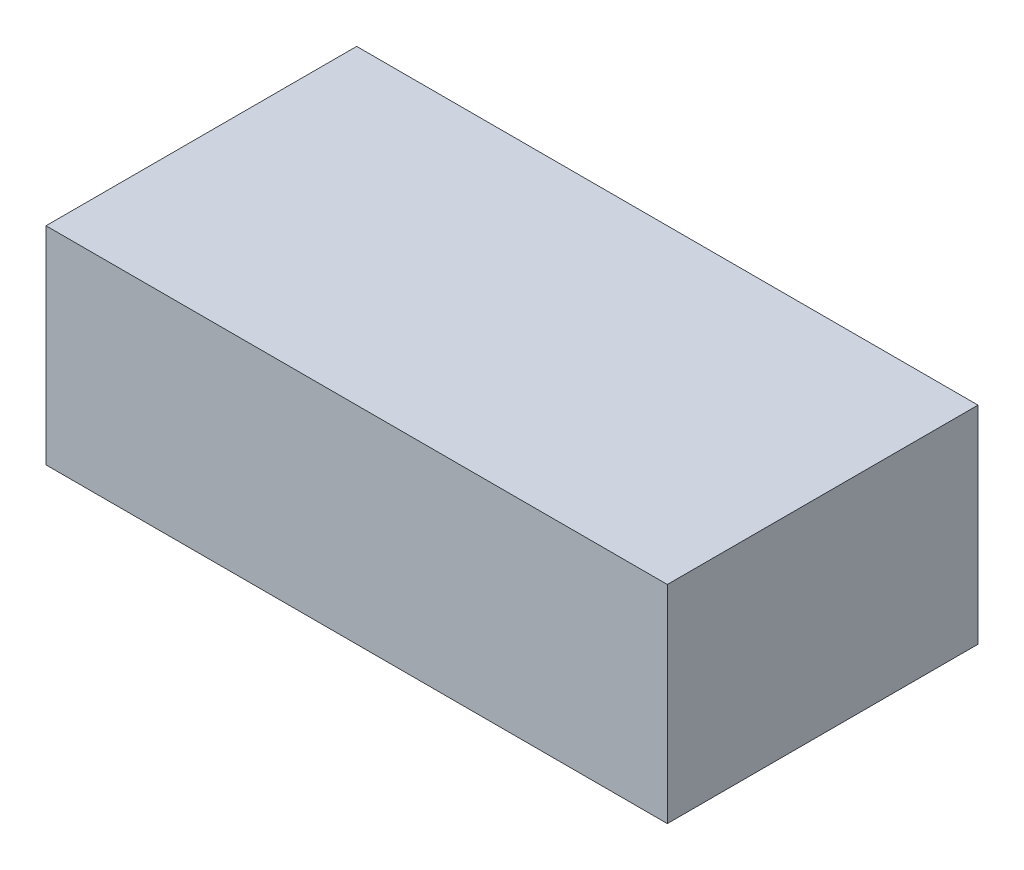
from build123d import *

# Parameters (mm, degrees)
SKETCH2_W           = 60
SKETCH2_H           = 30
BOSS_EXTRUDE1_DEPTH = 20


with BuildPart() as part:
    # Sketch2 → Boss-Extrude1 (new body)
    with BuildSketch(Plane(origin=(0, 0, 0), x_dir=(1, 0, 0), z_dir=(0, 1, 0))):
        Rectangle(SKETCH2_W, SKETCH2_H)
    extrude(amount=BOSS_EXTRUDE1_DEPTH)


solid = part.part
